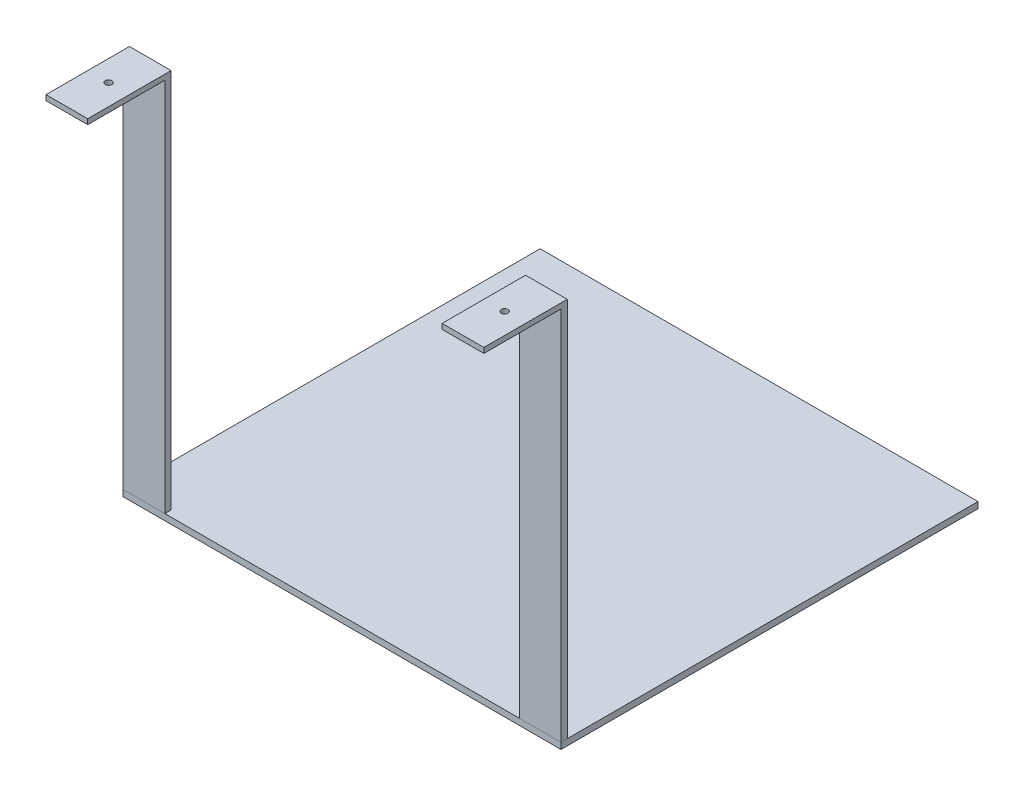
from build123d import *

# Parameters (mm, degrees)
SKETCH_1_W        = 20
SKETCH_1_H        = 40
SKETCH_1_R        = 1.6
EXTRUDE_1_DEPTH   = 2.5
EXTRUDE_1_2_DEPTH = 2.5
SKETCH_2_W        = 20
SKETCH_2_H        = 3
EXTRUDE_2_DEPTH   = 180
SKETCH_3_W        = 210
SKETCH_3_H        = 200
EXTRUDE_3_DEPTH   = 3


with BuildPart() as part:
    # 草图1 → 凸台-拉伸1 (new body)
    with BuildSketch(Plane(origin=(0, 0, 0), x_dir=(1, 0, 0), z_dir=(0, 1, 0))):
        Rectangle(SKETCH_1_W, SKETCH_1_H)
        with Locations(Location((0, 0, 0), (0, 0, 270))):
            Circle(SKETCH_1_R, mode=Mode.SUBTRACT)
    extrude(amount=EXTRUDE_1_DEPTH)



with BuildPart() as body_2:
    # 草图1 → Extrude 1 2 (new body)
    with BuildSketch(Plane(origin=(0, 0, 0), x_dir=(1, 0, 0), z_dir=(0, 1, 0))):
        with Locations((190, 0)):
            Rectangle(SKETCH_1_W, SKETCH_1_H)
        with Locations(Location((190, 0, 0), (0, 0, 90))):
            Circle(SKETCH_1_R, mode=Mode.SUBTRACT)
    extrude(amount=EXTRUDE_1_2_DEPTH)


with BuildPart() as part_1:
    add(part.part)

    add(body_2.part)  # 凸台-拉伸2 merges body 2
    # 草图2 → 凸台-拉伸2 (add)
    with BuildSketch(Plane.XZ):
        with Locations((0, -18.5)):
            Rectangle(SKETCH_2_W, SKETCH_2_H)
        with Locations((190, -18.5)):
            Rectangle(SKETCH_2_W, SKETCH_2_H)
    extrude(amount=EXTRUDE_2_DEPTH)


with BuildPart() as body_2_2:
    # 草图3 → 凸台-拉伸3 (new body)
    with BuildSketch(Plane.XZ.offset(180)):
        with Locations((95, -117)):
            Rectangle(SKETCH_3_W, SKETCH_3_H)
    extrude(amount=EXTRUDE_3_DEPTH)


solid = Compound([part_1.part, body_2_2.part])
